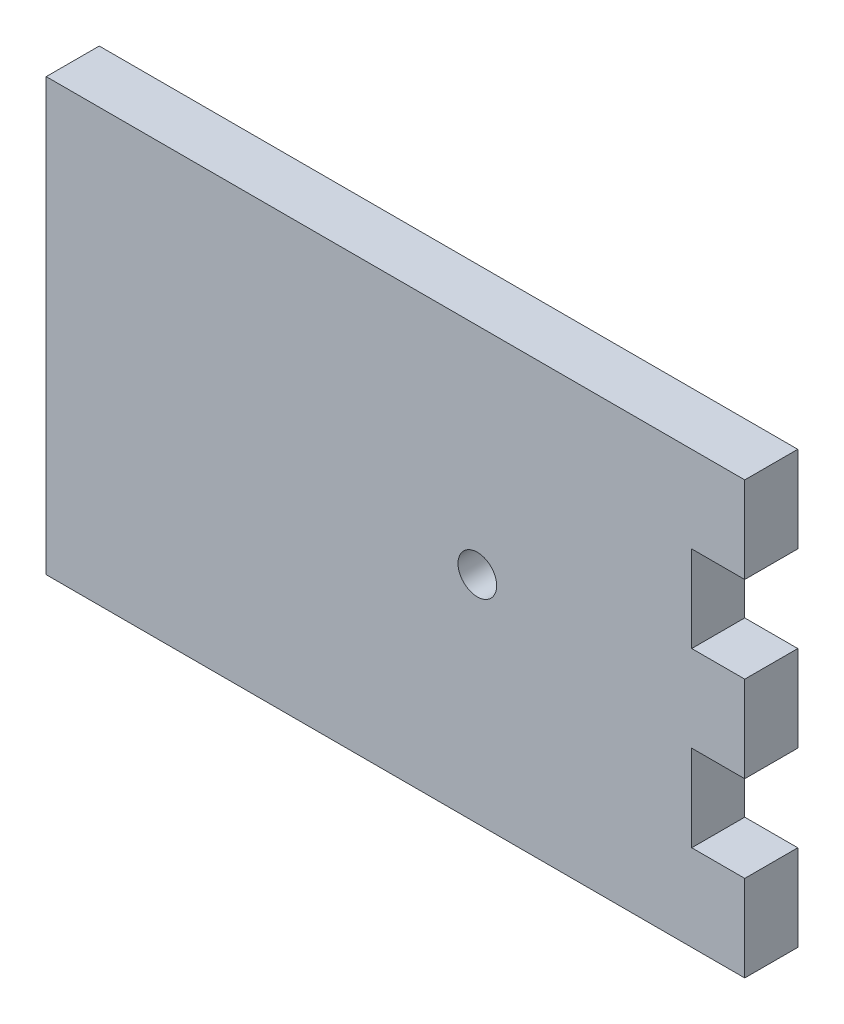
from build123d import *

# Parameters (mm, degrees)
SKETCH2_W           = 63.246
SKETCH2_H           = 39.058596
BOSS_EXTRUDE1_DEPTH = 4.800000052
SKETCH5_W           = 4.800000052
SKETCH5_H           = 7.8117192
CUT_EXTRUDE1_DEPTH  = 75.489398158
SKETCH6_R           = 1.750000056
CUT_EXTRUDE2_DEPTH  = 75.489398158


with BuildPart() as part:
    # Sketch2 → Boss-Extrude1 (new body)
    with BuildSketch(Plane.XY):
        with Locations((31.623, 19.529298)):
            Rectangle(SKETCH2_W, SKETCH2_H)
    extrude(amount=BOSS_EXTRUDE1_DEPTH)

    # Sketch5 → Cut-Extrude1 (cut, through all)
    with BuildSketch(Plane.XY.offset(4.800000052)):
        with Locations((60.845999974, 11.7175788)):
            Rectangle(SKETCH5_W, SKETCH5_H)
        with Locations((60.845999974, 27.3410172)):
            Rectangle(SKETCH5_W, SKETCH5_H)
    extrude(amount=-CUT_EXTRUDE1_DEPTH, mode=Mode.SUBTRACT)

    # Sketch6 → Cut-Extrude2 (cut, through all)
    with BuildSketch(Plane.XY.offset(4.800000052)):
        with Locations((39.032113706, 19.529298)):
            Circle(SKETCH6_R)
    extrude(amount=-CUT_EXTRUDE2_DEPTH, mode=Mode.SUBTRACT)


solid = part.part
